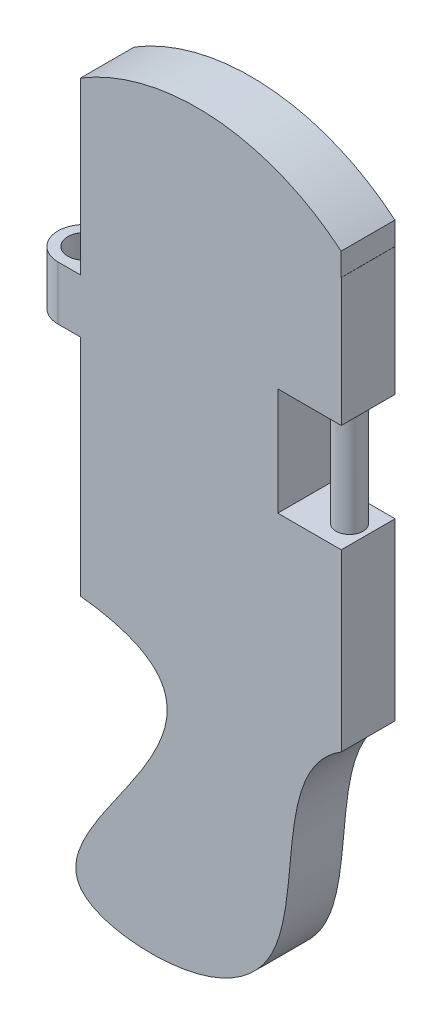
from build123d import *

# Parameters (mm, degrees)
SALIENTE_EXTRUIR1_DEPTH = 6
SALIENTE_EXTRUIR3_START = 25
SALIENTE_EXTRUIR3_DEPTH = 6
CROQUIS4_R              = 1.9
CORTAR_EXTRUIR1_DEPTH   = 6
CROQUIS5_W              = 8
CROQUIS5_H              = 12
CORTAR_EXTRUIR2_DEPTH   = 6
SALIENTE_EXTRUIR4_REACH = 60.245
CROQUIS6_R              = 1.5
CROQUIS7_W              = 0.924741671
CROQUIS7_H              = 48.494848299
CORTAR_EXTRUIR3_DEPTH   = 10
CROQUIS9_W              = 1.397328442
CROQUIS9_H              = 2.549049749
CORTAR_EXTRUIR4_DEPTH   = 6


with BuildPart() as part:
    # Croquis1 → Saliente-Extruir1 (new body)
    with BuildSketch(Plane.XY):
        with BuildLine():
            Line((0, 0), (0, 50))
            ThreePointArc((0, 50), (15.503123572, 53.531235724), (30, 47))
            Line((30, 47), (30, 0))
            add(Edge.make_bspline(
                [(0, 0), (23.872131175, -2.743163232), (-15.156120823, -28.820785067), (12.564482161, -31.62248958), (27.108369886, -22.134396226), (20.683535225, -4.609887129), (30, 0)],
                knots=[0, 0, 0, 0, 0.411785319, 0.564960897, 0.677132613, 1, 1, 1, 1], degree=3))
        make_face()
    extrude(amount=SALIENTE_EXTRUIR1_DEPTH)

    # Croquis2 → Saliente-Extruir3 (add)
    with BuildSketch(Plane(origin=(0, 0, 0), x_dir=(1, 0, 0), z_dir=(0, 1, 0)).offset(SALIENTE_EXTRUIR3_START)):
        with BuildLine():
            Line((-2.5, 0), (0, 0))
            Line((0, 0), (0, -6))
            Line((0, -6), (-2.5, -6))
            ThreePointArc((-2.5, -6), (-5.5, -3), (-2.5, 0))
        make_face()
    extrude(amount=SALIENTE_EXTRUIR3_DEPTH)

    # Croquis4 → Cortar-Extruir1 (cut)
    with BuildSketch(Plane(origin=(0, 31, 0), x_dir=(1, 0, 0), z_dir=(0, 1, 0))):
        with Locations(Location((-2.5, -3, 0), (0, 0, 270))):
            Circle(CROQUIS4_R)
    extrude(amount=-CORTAR_EXTRUIR1_DEPTH, mode=Mode.SUBTRACT)

    # Croquis5 → Cortar-Extruir2 (cut)
    with BuildSketch(Plane.XY.offset(6)):
        with Locations((26, 25)):
            Rectangle(CROQUIS5_W, CROQUIS5_H)
    extrude(amount=-CORTAR_EXTRUIR2_DEPTH, mode=Mode.SUBTRACT)

    # Croquis6 → Saliente-Extruir4 (add, up to next)
    with BuildSketch(Plane(origin=(0, 19, 0), x_dir=(1, 0, 0), z_dir=(0, 1, 0)), mode=Mode.PRIVATE) as saliente_extruir4_sk1:
        with Locations(Location((27, -3, 0), (0, 0, 90))):
            Circle(CROQUIS6_R)
    saliente_extruir4_tool1 = extrude(saliente_extruir4_sk1.sketch, amount=SALIENTE_EXTRUIR4_REACH, mode=Mode.PRIVATE) - part.part
    add(saliente_extruir4_tool1.solids().sort_by_distance((27, 19, 3))[0])

    # Croquis7 → Cortar-Extruir3 (cut)
    with BuildSketch(Plane.XY.offset(6)):
        with Locations((29.537629165, 22.752575851)):
            Rectangle(CROQUIS7_W, CROQUIS7_H)
    extrude(amount=-CORTAR_EXTRUIR3_DEPTH, mode=Mode.SUBTRACT)

    # Croquis9 → Cortar-Extruir4 (cut)
    with BuildSketch(Plane.XY.offset(6)):
        with Locations((29.758239574, 46.553382062)):
            Rectangle(CROQUIS9_W, CROQUIS9_H)
    extrude(amount=-CORTAR_EXTRUIR4_DEPTH, mode=Mode.SUBTRACT)


solid = part.part
